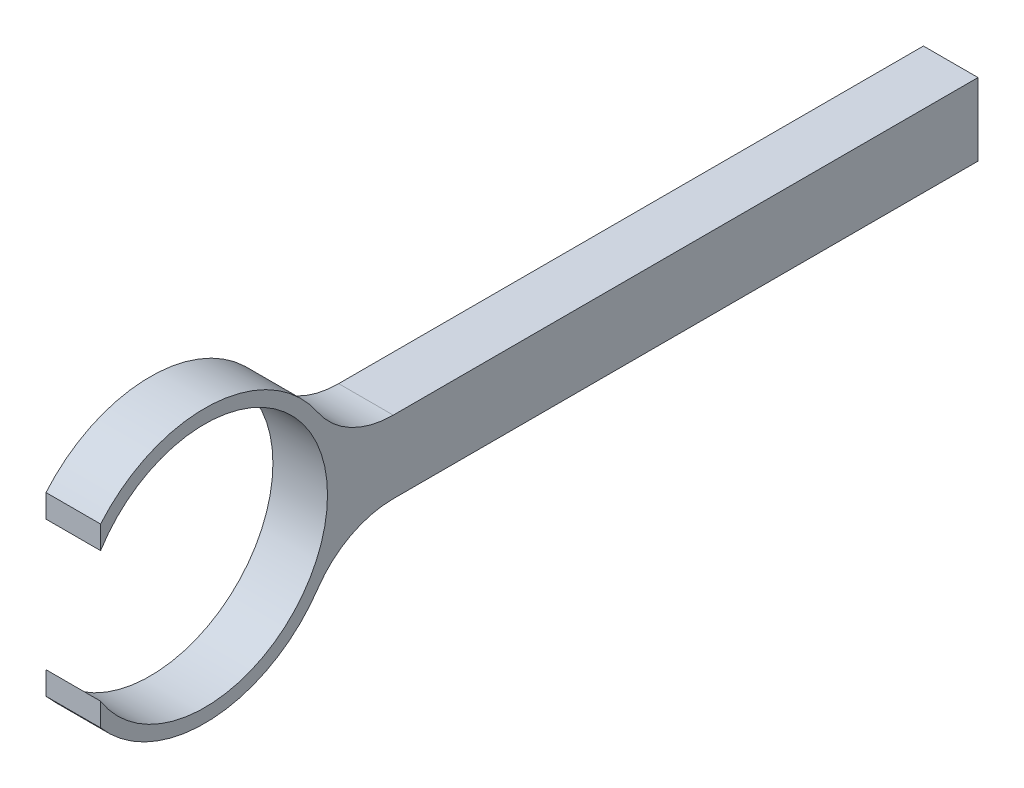
from build123d import *

# Parameters (mm, degrees)
BOSS_EXTRUDE1_DEPTH = 6
FILLET1_R           = 10


with BuildPart() as part:
    # Sketch1 → Boss-Extrude1 (new body)
    with BuildSketch(Plane(origin=(0, 0, 0), x_dir=(0, 0, -1), z_dir=(1, 0, 0))):
        with BuildLine():
            ThreePointArc((14.46231008, 3.980149137), (3.233438839, 14.647350384), (-11.442662362, 9.6987359))
            Line((-11.442662362, 9.6987359), (-11.442662362, 7.163482258))
            ThreePointArc((-11.442662362, 7.163482258), (13.5, 0), (-11.442662362, -7.163482258))
            Line((-11.442662362, -7.163482258), (-11.442662362, -9.6987359))
            ThreePointArc((-11.442662362, -9.6987359), (3.233438839, -14.647350384), (14.46231008, -3.980149137))
            Line((14.46231008, -3.980149137), (85, -3.980149137))
            Line((85, -3.980149137), (85, 3.980149137))
            Line((85, 3.980149137), (14.46231008, 3.980149137))
        make_face()
    extrude(amount=BOSS_EXTRUDE1_DEPTH)

    # Fillet1
    fillet1_edges = [part.edges().sort_by_distance(p)[0] for p in [
        (3, 3.980149137, -14.46231008),
        (3, -3.980149137, -14.46231008),
    ]]
    fillet(fillet1_edges, radius=FILLET1_R)


solid = part.part
